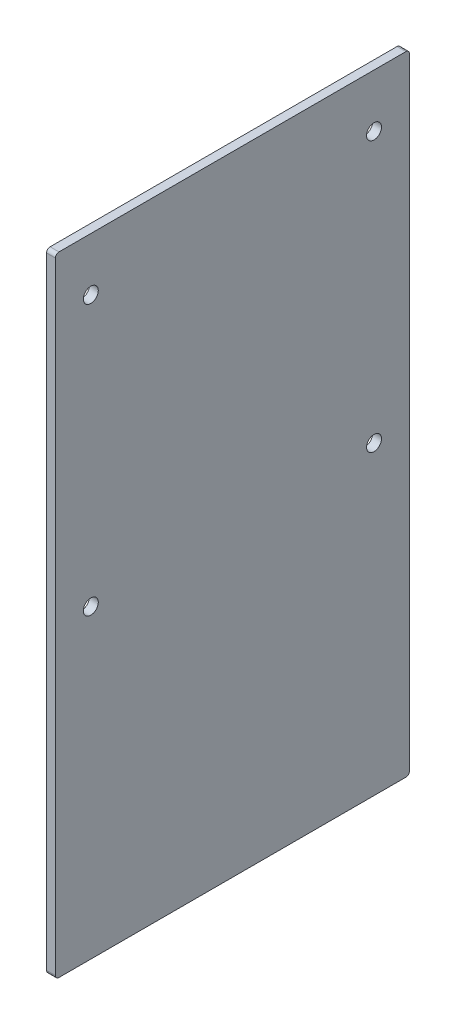
from build123d import *

# Parameters (mm, degrees)
SKETCH1_W                        = 254
SKETCH1_H                        = 438.15
BOSS_EXTRUDE1_DEPTH              = 6.35
F_27_64_0_42188_DIAMETER_HOLE1_D = 10.715752
SKETCH4_W                        = 254
SKETCH4_H                        = 12.7
BOSS_EXTRUDE2_DEPTH              = 6.35
FILLET1_R                        = 2.54


with BuildPart() as part:
    # Sketch1 → Boss-Extrude1 (new body)
    with BuildSketch(Plane(origin=(0, 0, 0), x_dir=(0, 0, -1), z_dir=(1, 0, 0))):
        with Locations((127, 219.075)):
            Rectangle(SKETCH1_W, SKETCH1_H)
    extrude(amount=BOSS_EXTRUDE1_DEPTH)

    # 27/64 (0.42188) Diameter Hole1 (through all)
    with Locations(Plane(origin=(6.35, 0, 0), x_dir=(0, 0, -1), z_dir=(1, 0, 0))):
        with Locations((25.4, 412.75), (25.4, 219.075), (228.6, 219.075), (228.6, 412.75)):
            Hole(F_27_64_0_42188_DIAMETER_HOLE1_D / 2)

    # Sketch4 → Boss-Extrude2 (add)
    with BuildSketch(Plane(origin=(6.35, 0, 0), x_dir=(0, 0, -1), z_dir=(1, 0, 0))):
        with Locations((127, 444.5)):
            Rectangle(SKETCH4_W, SKETCH4_H)
    extrude(amount=-BOSS_EXTRUDE2_DEPTH)

    # Fillet1
    fillet1_edges = [part.edges().sort_by_distance(p)[0] for p in [
        (3.175, 450.85, -254),
        (3.175, 450.85, 0),
        (3.175, 0, -254),
        (3.175, 0, 0),
    ]]
    fillet(fillet1_edges, radius=FILLET1_R)


solid = part.part
